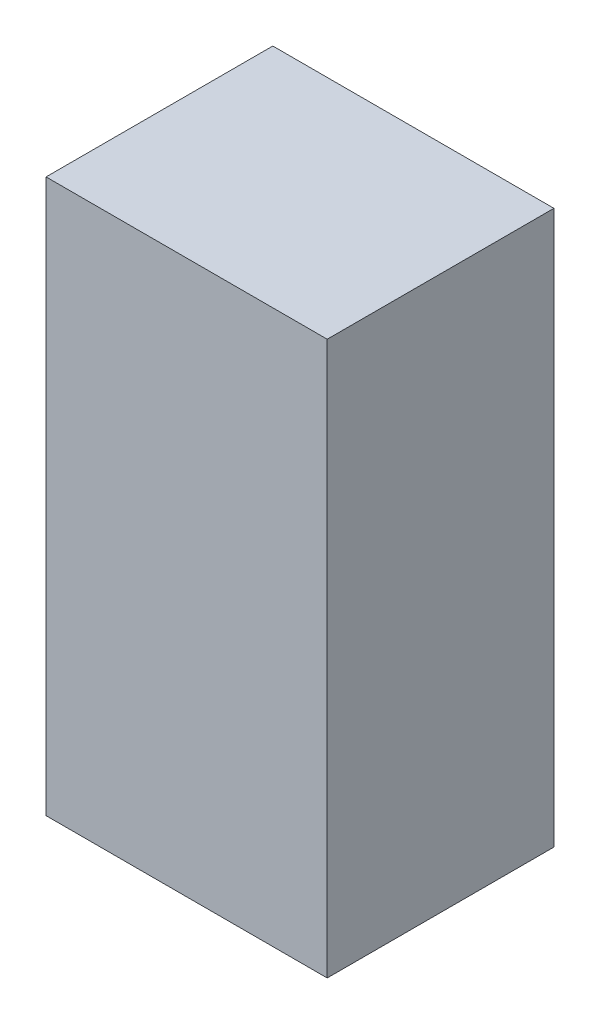
from build123d import *

# Parameters (mm, degrees)
SKETCH1_W           = 31
SKETCH1_H           = 61
BOSS_EXTRUDE1_DEPTH = 25


with BuildPart() as part:
    # Sketch1 → Boss-Extrude1 (new body)
    with BuildSketch(Plane.XY):
        Rectangle(SKETCH1_W, SKETCH1_H)
    extrude(amount=BOSS_EXTRUDE1_DEPTH)


solid = part.part
